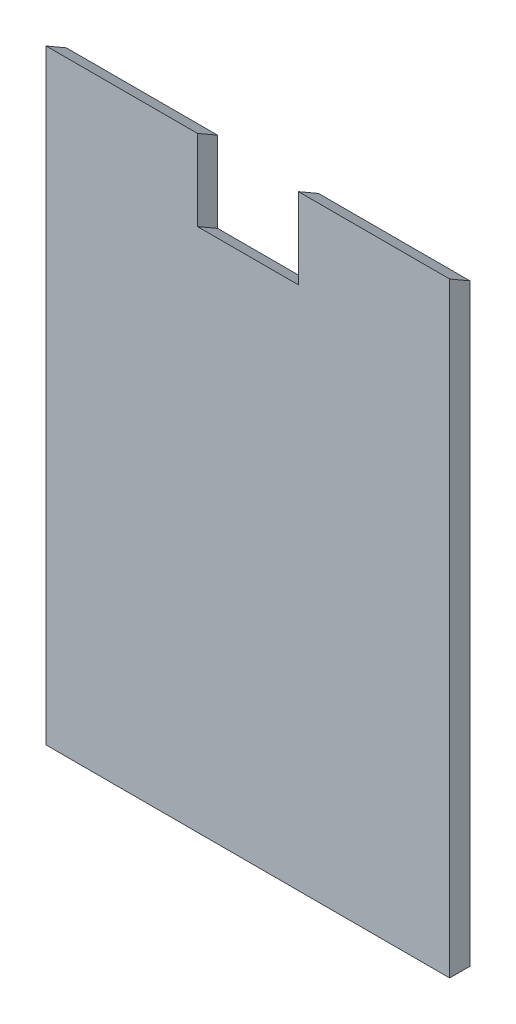
from build123d import *

# Parameters (mm, degrees)
BOSS_EXTRUDE1_DEPTH = 6.35
CUT_EXTRUDE1_DEPTH  = 31.75
CUT_EXTRUDE2_DEPTH  = 127


with BuildPart() as part:
    # Sketch1 → Boss-Extrude1 (new, symmetric)
    with BuildSketch(Plane.XY):
        Polygon((127, -190.5), (-127, -190.5), (-127, 190.5), (-31.75, 190.5), (-31.75, 139.7), (31.75, 139.7), (31.75, 190.5), (127, 190.5), align=None)
    extrude(amount=BOSS_EXTRUDE1_DEPTH, both=True)

    # Sketch4 → Cut-Extrude1 (cut, symmetric)
    with BuildSketch(Plane(origin=(0, 0, 0), x_dir=(0, 0, -1), z_dir=(1, 0, 0))):
        Polygon((-6.35, 139.7), (6.35, 139.7), (6.35, 132.367651581), align=None)
        Polygon((-6.35, 190.5), (6.35, 190.5), (6.35, 183.167651581), align=None)
    extrude(amount=CUT_EXTRUDE1_DEPTH, both=True, mode=Mode.SUBTRACT)

    # Sketch5 → Cut-Extrude2 (cut, symmetric)
    with BuildSketch(Plane(origin=(0, 0, 0), x_dir=(0, 0, -1), z_dir=(1, 0, 0))):
        Polygon((-6.35, 190.5), (6.35, 190.5), (6.35, 183.167651581), align=None)
    extrude(amount=CUT_EXTRUDE2_DEPTH, both=True, mode=Mode.SUBTRACT)


solid = part.part
